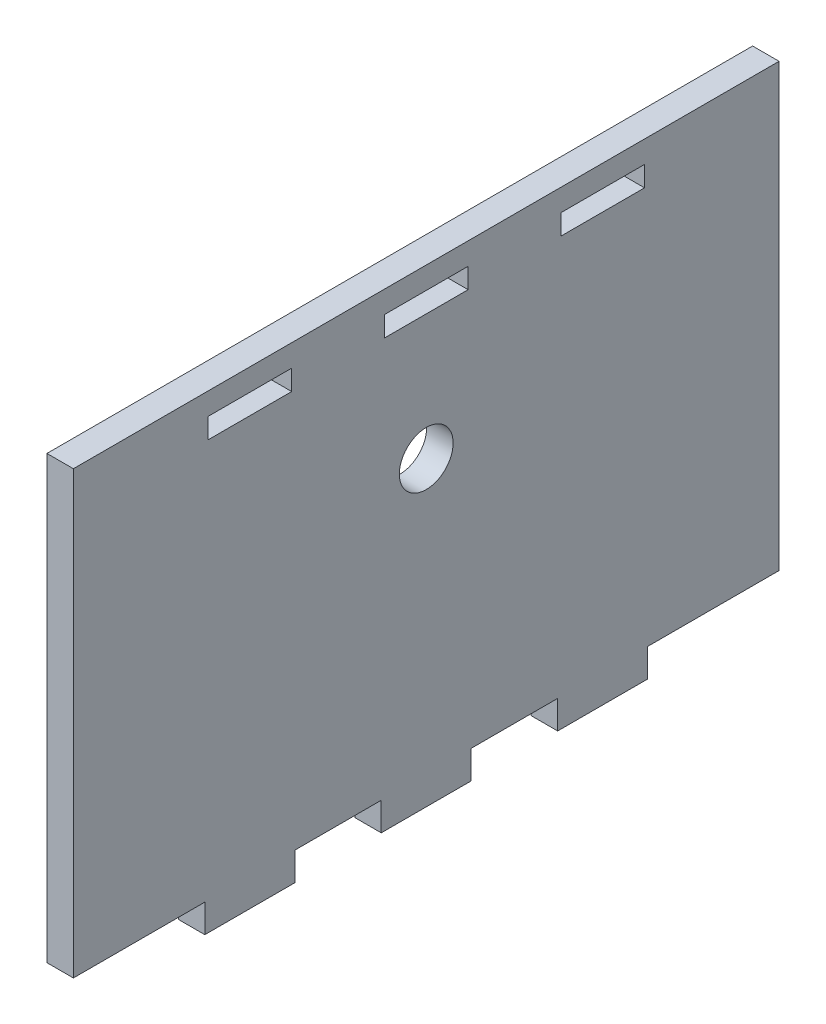
from build123d import *

# Parameters (mm, degrees)
CROQUIS1_R              = 3.05
CROQUIS1_W              = 9.5
CROQUIS1_H              = 2.3
SALIENTE_EXTRUIR1_DEPTH = 3


with BuildPart() as part:
    # Croquis1 → Saliente-Extruir1 (new body)
    with BuildSketch(Plane(origin=(0, 0, 0), x_dir=(0, 0, -1), z_dir=(1, 0, 0))):
        Polygon((-14.9, -25), (-5.1, -25), (-5.1, -28.2), (5.1, -28.2), (5.1, -25), (14.9, -25), (14.9, -28.2), (25.1, -28.2), (25.1, -25), (40, -25), (40, 25), (-40, 25), (-40, -25), (-25.1, -25), (-25.1, -28.2), (-14.9, -28.2), align=None)
        with Locations((0, 6)):
            Circle(CROQUIS1_R, mode=Mode.SUBTRACT)
        with Locations((-20, 21.35)):
            Rectangle(CROQUIS1_W, CROQUIS1_H, mode=Mode.SUBTRACT)
        with Locations((0, 21.35)):
            Rectangle(CROQUIS1_W, CROQUIS1_H, mode=Mode.SUBTRACT)
        with Locations((20, 21.35)):
            Rectangle(CROQUIS1_W, CROQUIS1_H, mode=Mode.SUBTRACT)
    extrude(amount=SALIENTE_EXTRUIR1_DEPTH)


solid = part.part
